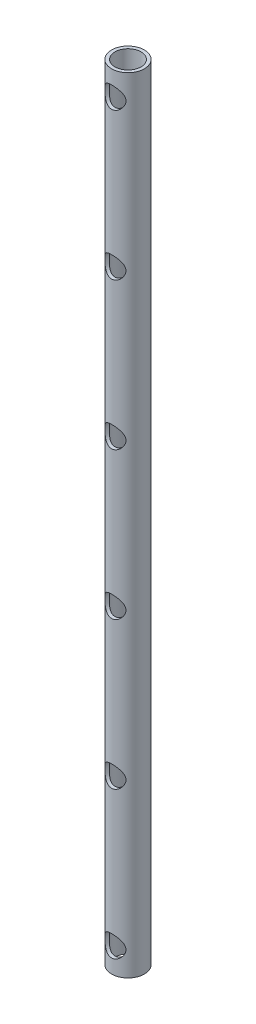
from build123d import *

# Parameters (mm, degrees)
SKETCH1_R           = 16.7
SKETCH1_R_2         = 13.32
BOSS_EXTRUDE1_DEPTH = 400
SKETCH2_R           = 10.75
CUT_EXTRUDE1_DEPTH  = 40
LPATTERN1_COUNT     = 16
LPATTERN1_PITCH     = 150


with BuildPart() as part:
    # Sketch1 → Boss-Extrude1 (new, symmetric)
    with BuildSketch(Plane(origin=(0, 0, 0), x_dir=(1, 0, 0), z_dir=(0, 1, 0))):
        with Locations(Location((0, 0, 0), (0, 0, 270))):
            Circle(SKETCH1_R)
        with Locations(Location((0, 0, 0), (0, 0, 270))):
            Circle(SKETCH1_R_2, mode=Mode.SUBTRACT)
    extrude(amount=BOSS_EXTRUDE1_DEPTH, both=True)

    # Sketch2 → Cut-Extrude1 (cut)
    with BuildSketch(Plane.XY):
        with Locations(Location((0, 375, 0), (0, 0, 180))):
            Circle(SKETCH2_R)
    cut_extrude1 = extrude(amount=CUT_EXTRUDE1_DEPTH, mode=Mode.SUBTRACT)

    # LPattern1: Cut-Extrude1 ×16
    with Locations(*[(0, -i * LPATTERN1_PITCH, 0) for i in range(1, LPATTERN1_COUNT)]):
        add(cut_extrude1, mode=Mode.SUBTRACT)


solid = part.part
